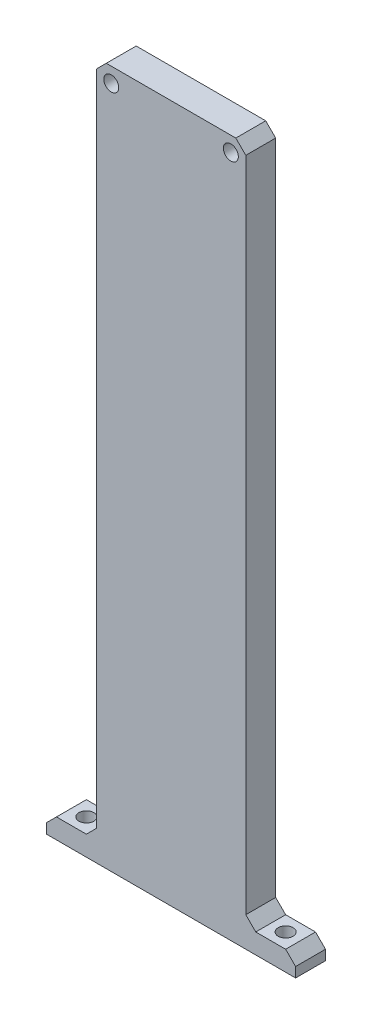
from build123d import *

# Parameters (mm, degrees)
SKETCH1_W           = 30
SKETCH1_H           = 140
BOSS_EXTRUDE1_DEPTH = 6
CHAMFER1_SIZE       = 2
SKETCH2_R           = 1.5
CUT_EXTRUDE1_DEPTH  = 6
SKETCH3_W           = 10
SKETCH3_H           = 6
BOSS_EXTRUDE2_DEPTH = 4
CHAMFER2_SIZE       = 2
SKETCH4_R           = 1.5
CUT_EXTRUDE2_DEPTH  = 142.887279204


with BuildPart() as part:
    # Sketch1 → Boss-Extrude1 (new body)
    with BuildSketch(Plane.XY):
        with Locations((15, 70)):
            Rectangle(SKETCH1_W, SKETCH1_H)
    extrude(amount=BOSS_EXTRUDE1_DEPTH)

    # Chamfer1
    chamfer1_edges = [part.edges().sort_by_distance(p)[0] for p in [
        (0, 140, 3),
        (30, 140, 3),
    ]]
    chamfer(chamfer1_edges, length=CHAMFER1_SIZE)

    # Sketch2 → Cut-Extrude1 (cut)
    with BuildSketch(Plane.XY.offset(6)):
        with Locations((3, 137)):
            Circle(SKETCH2_R)
        with Locations((27, 137)):
            Circle(SKETCH2_R)
    extrude(amount=-CUT_EXTRUDE1_DEPTH, mode=Mode.SUBTRACT)

    # Sketch3 → Boss-Extrude2 (add)
    with BuildSketch(Plane(origin=(0, 0, 0), x_dir=(1, 0, 0), z_dir=(0, 1, 0))):
        with Locations((-5, -3)):
            Rectangle(SKETCH3_W, SKETCH3_H)
        with Locations((35, -3)):
            Rectangle(SKETCH3_W, SKETCH3_H)
    extrude(amount=BOSS_EXTRUDE2_DEPTH)

    # Chamfer2
    chamfer2_edges = [part.edges().sort_by_distance(p)[0] for p in [
        (0, 4, 3),
        (-10, 4, 3),
        (30, 4, 3),
        (40, 4, 3),
    ]]
    chamfer(chamfer2_edges, length=CHAMFER2_SIZE)

    # Sketch4 → Cut-Extrude2 (cut, through all)
    with BuildSketch(Plane(origin=(0, 4, 0), x_dir=(1, 0, 0), z_dir=(0, 1, 0))):
        with Locations(Location((-5, -3, 0), (0, 0, 270))):
            Circle(SKETCH4_R)
        with Locations(Location((35, -3, 0), (0, 0, 270))):
            Circle(SKETCH4_R)
    extrude(amount=-CUT_EXTRUDE2_DEPTH, mode=Mode.SUBTRACT)


solid = part.part
